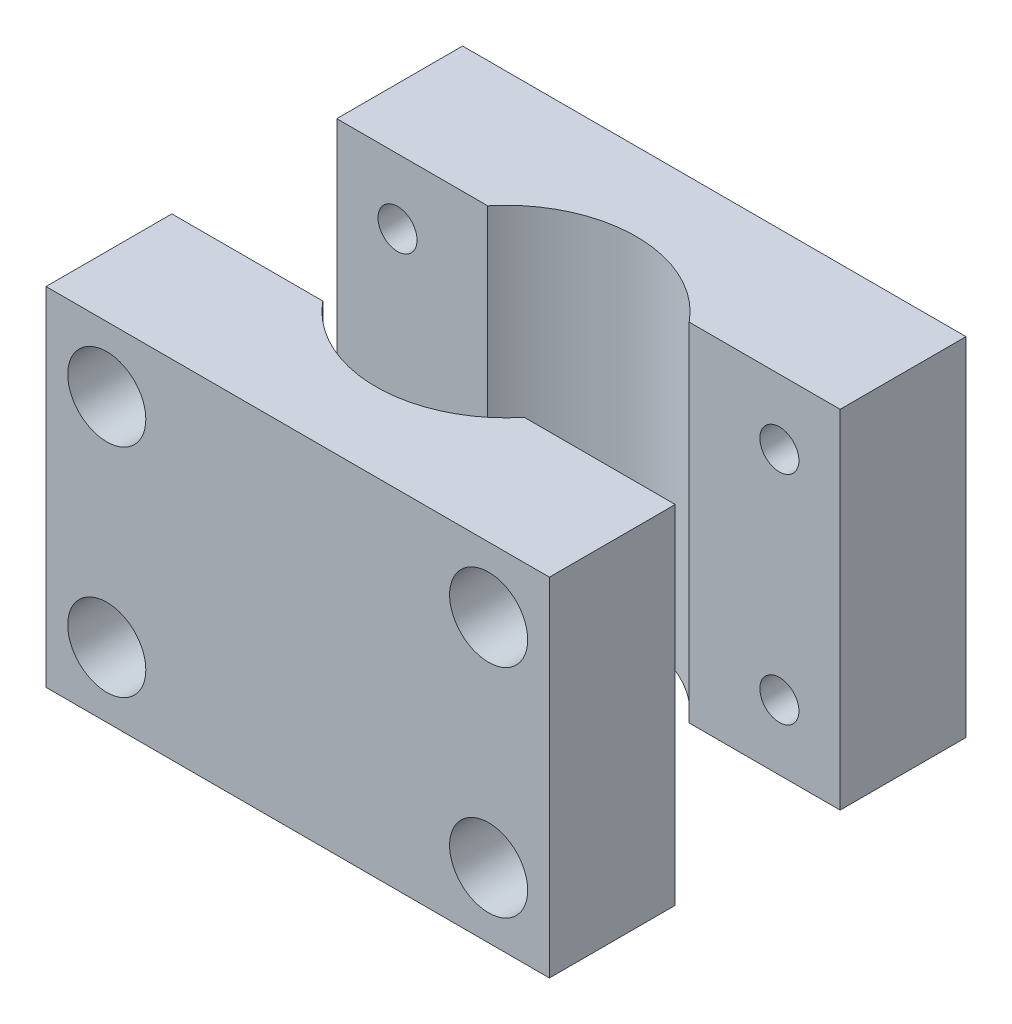
from build123d import *

# Parameters (mm, degrees)
BOSS_EXTRUDE1_DEPTH   = 20
BOSS_EXTRUDE1_2_DEPTH = 20
SKETCH2_R             = 2.25
CUT_EXTRUDE1_DEPTH    = 60.539902586
SKETCH3_R             = 4.5
CUT_EXTRUDE2_DEPTH    = 7
CUT_EXTRUDE3_START    = -35
CUT_EXTRUDE3_DEPTH    = 20.055527007


with BuildPart() as part:
    # Sketch1 → Boss-Extrude1 (new, symmetric)
    with BuildSketch(Plane(origin=(0, 0, 0), x_dir=(1, 0, 0), z_dir=(0, 1, 0))):
        with BuildLine():
            Line((29, -9.5), (29, -24))
            Line((29, -24), (-29, -24))
            Line((-29, -24), (-29, -9.5))
            Line((-29, -9.5), (-11.608186766, -9.5))
            ThreePointArc((-11.608186766, -9.5), (0, -15), (11.608186766, -9.5))
            Line((11.608186766, -9.5), (29, -9.5))
        make_face()
    extrude(amount=BOSS_EXTRUDE1_DEPTH, both=True)


with BuildPart() as body_2:
    # Sketch1 → Boss-Extrude1 2 (new, symmetric)
    with BuildSketch(Plane(origin=(0, 0, 0), x_dir=(1, 0, 0), z_dir=(0, 1, 0))):
        with BuildLine():
            Line((-29, 24), (29, 24))
            Line((29, 24), (29, 9.5))
            Line((29, 9.5), (11.608186766, 9.5))
            ThreePointArc((11.608186766, 9.5), (0, 15), (-11.608186766, 9.5))
            Line((-11.608186766, 9.5), (-29, 9.5))
            Line((-29, 9.5), (-29, 24))
        make_face()
    extrude(amount=BOSS_EXTRUDE1_2_DEPTH, both=True)


with BuildPart() as cut_extrude1_tool:
    # Sketch2 → Cut-Extrude1 (new, through all)
    with BuildSketch(Plane.XY.offset(24)):
        with Locations((22, 12.5)):
            Circle(SKETCH2_R)
        with Locations((22, -12.5)):
            Circle(SKETCH2_R)
        with Locations((-22, -12.5)):
            Circle(SKETCH2_R)
        with Locations((-22, 12.5)):
            Circle(SKETCH2_R)
    extrude(amount=-CUT_EXTRUDE1_DEPTH)


with BuildPart() as part_1:
    add(part.part)

    # Cut-Extrude1: cut by cut_extrude1_tool
    add(cut_extrude1_tool.part, mode=Mode.SUBTRACT)

    # Sketch3 → Cut-Extrude2 (cut)
    with BuildSketch(Plane.XY.offset(24)):
        with Locations((22, 12.5)):
            Circle(SKETCH3_R)
        with Locations((22, -12.5)):
            Circle(SKETCH3_R)
        with Locations((-22, -12.5)):
            Circle(SKETCH3_R)
        with Locations((-22, 12.5)):
            Circle(SKETCH3_R)
    extrude(amount=-CUT_EXTRUDE2_DEPTH, mode=Mode.SUBTRACT)


with BuildPart() as body_2_1:
    add(body_2.part)

    # Cut-Extrude1: cut by cut_extrude1_tool
    add(cut_extrude1_tool.part, mode=Mode.SUBTRACT)

    # Sketch4 → Cut-Extrude3 (cut, through all)
    with BuildSketch(Plane.XY.offset(17).offset(CUT_EXTRUDE3_START)):
        Polygon((22, 8.169872981), (25.75, 10.334936491), (25.75, 14.665063509), (22, 16.830127019), (18.25, 14.665063509), (18.25, 10.334936491), align=None)
        Polygon((22, -16.830127019), (25.75, -14.665063509), (25.75, -10.334936491), (22, -8.169872981), (18.25, -10.334936491), (18.25, -14.665063509), align=None)
        Polygon((-22, -16.830127019), (-18.25, -14.665063509), (-18.25, -10.334936491), (-22, -8.169872981), (-25.75, -10.334936491), (-25.75, -14.665063509), align=None)
        Polygon((-22, 8.169872981), (-18.25, 10.334936491), (-18.25, 14.665063509), (-22, 16.830127019), (-25.75, 14.665063509), (-25.75, 10.334936491), align=None)
    extrude(amount=-CUT_EXTRUDE3_DEPTH, mode=Mode.SUBTRACT)


solid = Compound([part_1.part, body_2_1.part])
